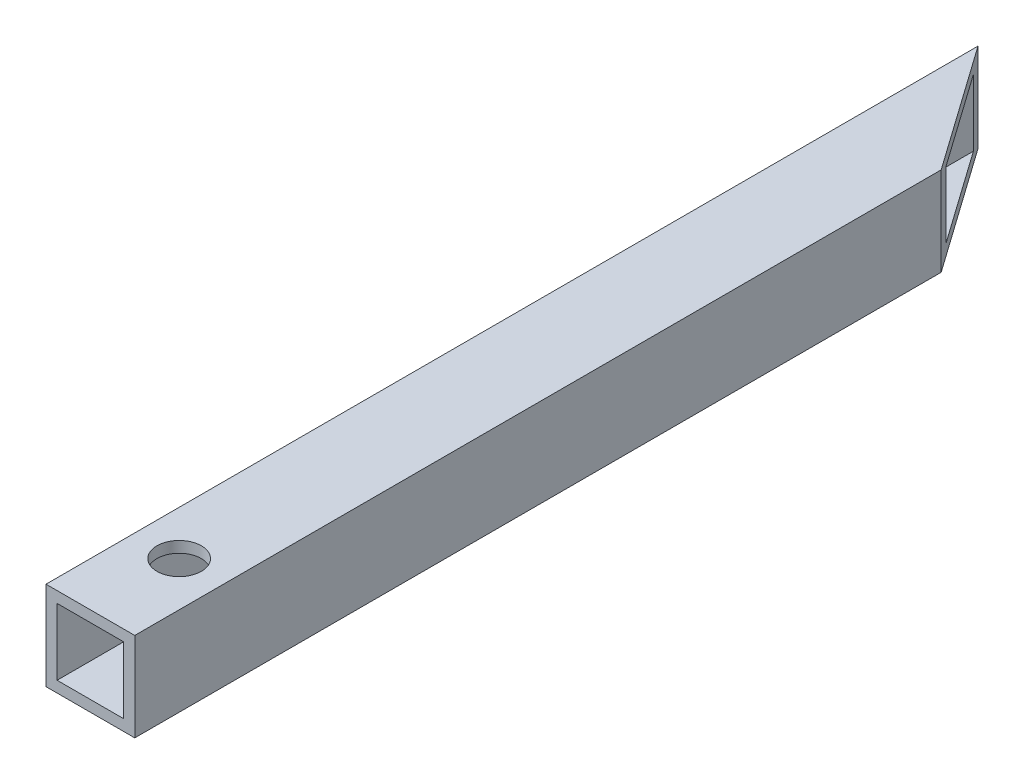
from build123d import *

# Parameters (mm, degrees)
SKETCH1_W           = 25.4
SKETCH1_H           = 25.4
SKETCH1_W_2         = 19.05
SKETCH1_H_2         = 19.05
BOSS_EXTRUDE1_DEPTH = 266.7
CUT_EXTRUDE1_REACH  = 271.108
SKETCH3_R           = 6.35
CUT_EXTRUDE2_DEPTH  = 270.108175275


with BuildPart() as part:
    # Sketch1 → Boss-Extrude1 (new body)
    with BuildSketch(Plane.XY):
        with Locations((12.7, 12.7)):
            Rectangle(SKETCH1_W, SKETCH1_H)
        with Locations((12.7, 12.7)):
            Rectangle(SKETCH1_W_2, SKETCH1_H_2, mode=Mode.SUBTRACT)
    extrude(amount=BOSS_EXTRUDE1_DEPTH)

    # Sketch2 → Cut-Extrude1 (cut, up to next)
    with BuildSketch(Plane(origin=(0, 25.4, 0), x_dir=(1, 0, 0), z_dir=(0, 1, 0)), mode=Mode.PRIVATE) as cut_extrude1_sk1:
        Polygon((25.4, -35.938150335), (0, 0), (25.4, 0), align=None)
    cut_extrude1_tool1 = extrude(cut_extrude1_sk1.sketch, amount=-CUT_EXTRUDE1_REACH, mode=Mode.PRIVATE) & part.part
    add(cut_extrude1_tool1.solids().sort_by_distance((16.933333, 25.4, 11.979383))[0], mode=Mode.SUBTRACT)

    # Sketch3 → Cut-Extrude2 (cut, through all)
    with BuildSketch(Plane(origin=(0, 25.4, 0), x_dir=(1, 0, 0), z_dir=(0, 1, 0))):
        with Locations(Location((12.7, -241.3, 0), (0, 0, 270))):
            Circle(SKETCH3_R)
    extrude(amount=-CUT_EXTRUDE2_DEPTH, mode=Mode.SUBTRACT)


solid = part.part
